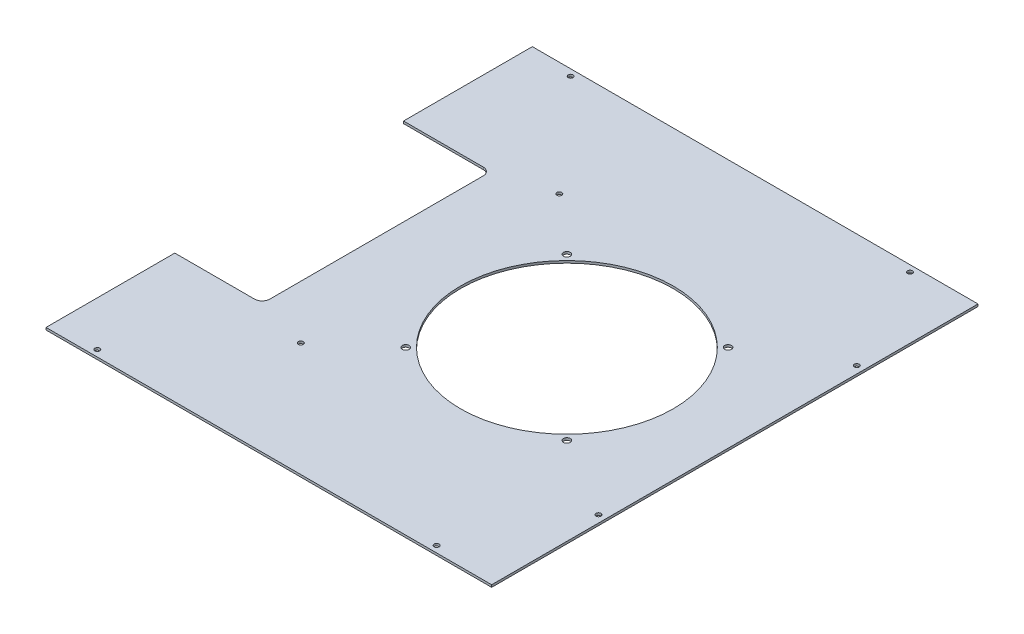
from build123d import *

# Parameters (mm, degrees)
SKETCH_1_W          = 586.5
SKETCH_1_H          = 640
EXTRUDE_1_DEPTH     = 3
CUT_EXTRUDE_1_DEPTH = 3
SKETCH_3_R          = 140
CUT_EXTRUDE_2_DEPTH = 3
SKETCH_4_R          = 4.5
CUT_EXTRUDE_3_DEPTH = 869.09633682
SKETCH_5_R          = 3.25
CUT_EXTRUDE_4_DEPTH = 869.09633682


with BuildPart() as part:
    # 스케치1 → 보스-돌출1 (new body)
    with BuildSketch(Plane(origin=(0, 0, 0), x_dir=(1, 0, 0), z_dir=(0, 1, 0))):
        with Locations((293.25, 320)):
            Rectangle(SKETCH_1_W, SKETCH_1_H)
    extrude(amount=EXTRUDE_1_DEPTH)

    # 스케치2 → 컷-돌출1 (cut)
    with BuildSketch(Plane(origin=(0, 3, 0), x_dir=(1, 0, 0), z_dir=(0, 1, 0))):
        with BuildLine():
            Line((0, 470.5), (105, 470.5))
            ThreePointArc((105, 470.5), (112.071067812, 467.571067812), (115, 460.5))
            Line((115, 460.5), (115, 179.5))
            ThreePointArc((115, 179.5), (112.071067812, 172.428932188), (105, 169.5))
            Line((105, 169.5), (0, 169.5))
            Line((0, 169.5), (0, 470.5))
        make_face()
    extrude(amount=-CUT_EXTRUDE_1_DEPTH, mode=Mode.SUBTRACT)

    # 스케치3 → 컷-돌출2 (cut)
    with BuildSketch(Plane(origin=(0, 3, 0), x_dir=(1, 0, 0), z_dir=(0, 1, 0))):
        with Locations(Location((365.5, 320, 0), (0, 0, 270))):
            Circle(SKETCH_3_R)
    extrude(amount=-CUT_EXTRUDE_2_DEPTH, mode=Mode.SUBTRACT)

    # 스케치4 → 컷-돌출3 (cut, through all)
    with BuildSketch(Plane(origin=(0, 3, 0), x_dir=(1, 0, 0), z_dir=(0, 1, 0))):
        with Locations(Location((259.433982822, 426.066017178, 0), (0, 0, 270))):
            Circle(SKETCH_4_R)
        with Locations(Location((471.566017178, 426.066017178, 0), (0, 0, 270))):
            Circle(SKETCH_4_R)
        with Locations(Location((471.566017178, 213.933982822, 0), (0, 0, 270))):
            Circle(SKETCH_4_R)
        with Locations(Location((259.433982822, 213.933982822, 0), (0, 0, 270))):
            Circle(SKETCH_4_R)
    extrude(amount=-CUT_EXTRUDE_3_DEPTH, mode=Mode.SUBTRACT)

    # 스케치5 → 컷-돌출4 (cut, through all)
    with BuildSketch(Plane(origin=(0, 3, 0), x_dir=(1, 0, 0), z_dir=(0, 1, 0))):
        with Locations(Location((59, 631.5, 0), (0, 0, 270))):
            Circle(SKETCH_5_R)
        with Locations(Location((505.5, 631.5, 0), (0, 0, 270))):
            Circle(SKETCH_5_R)
        with Locations(Location((185.5, 490, 0), (0, 0, 270))):
            Circle(SKETCH_5_R)
        with Locations(Location((577, 490, 0), (0, 0, 270))):
            Circle(SKETCH_5_R)
        with Locations(Location((577, 150, 0), (0, 0, 90))):
            Circle(SKETCH_5_R)
        with Locations(Location((185.5, 150, 0), (0, 0, 90))):
            Circle(SKETCH_5_R)
        with Locations(Location((505.5, 8.5, 0), (0, 0, 90))):
            Circle(SKETCH_5_R)
        with Locations(Location((59, 8.5, 0), (0, 0, 90))):
            Circle(SKETCH_5_R)
    extrude(amount=-CUT_EXTRUDE_4_DEPTH, mode=Mode.SUBTRACT)


solid = part.part
